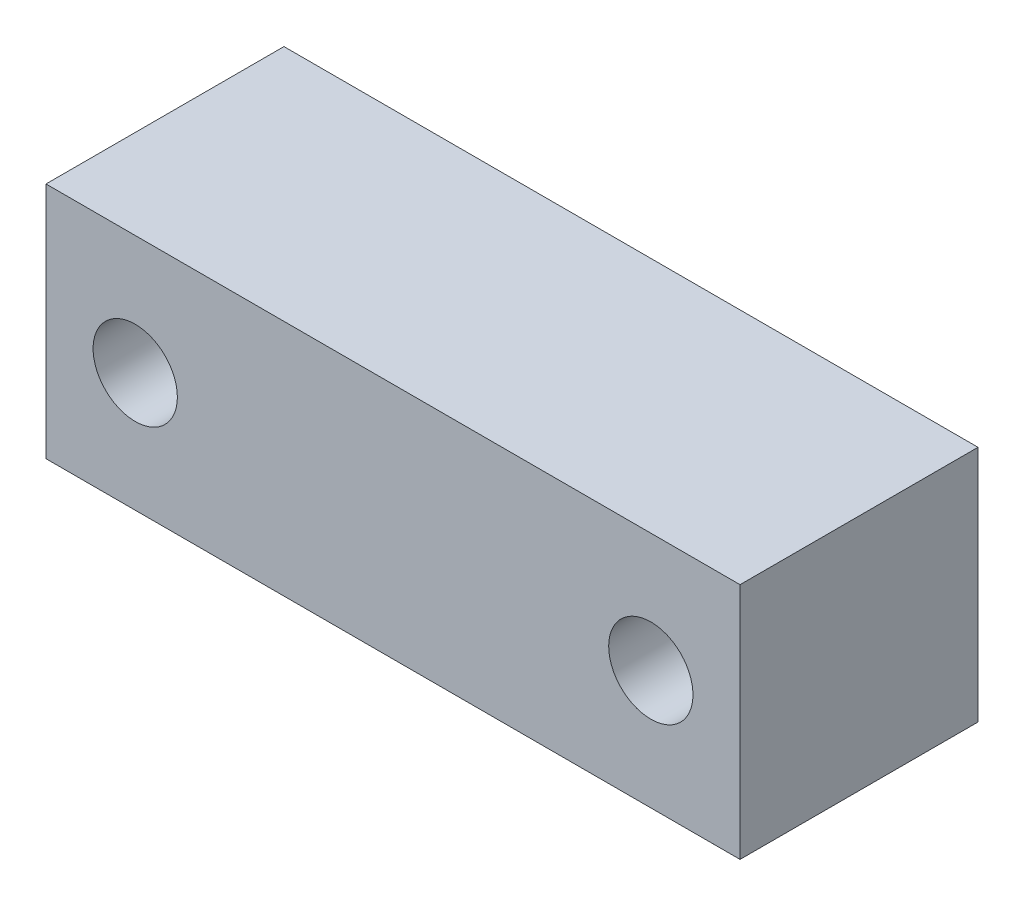
from build123d import *

# Parameters (mm, degrees)
SKETCH_1_W          = 70
SKETCH_1_H          = 24
EXTRUDE_1_DEPTH     = 24
SKETCH_2_R          = 4.25
CUT_EXTRUDE_1_DEPTH = 78.794601355


with BuildPart() as part:
    # 草图1 → 凸台-拉伸1 (new body)
    with BuildSketch(Plane.XY):
        with Locations((35, 12)):
            Rectangle(SKETCH_1_W, SKETCH_1_H)
    extrude(amount=EXTRUDE_1_DEPTH)

    # 草图2 → 切除-拉伸1 (cut, through all)
    with BuildSketch(Plane.XY.offset(24)):
        with Locations((9, 12)):
            Circle(SKETCH_2_R)
        with Locations(Location((61, 12, 0), (0, 0, 180))):
            Circle(SKETCH_2_R)
    extrude(amount=-CUT_EXTRUDE_1_DEPTH, mode=Mode.SUBTRACT)


solid = part.part
